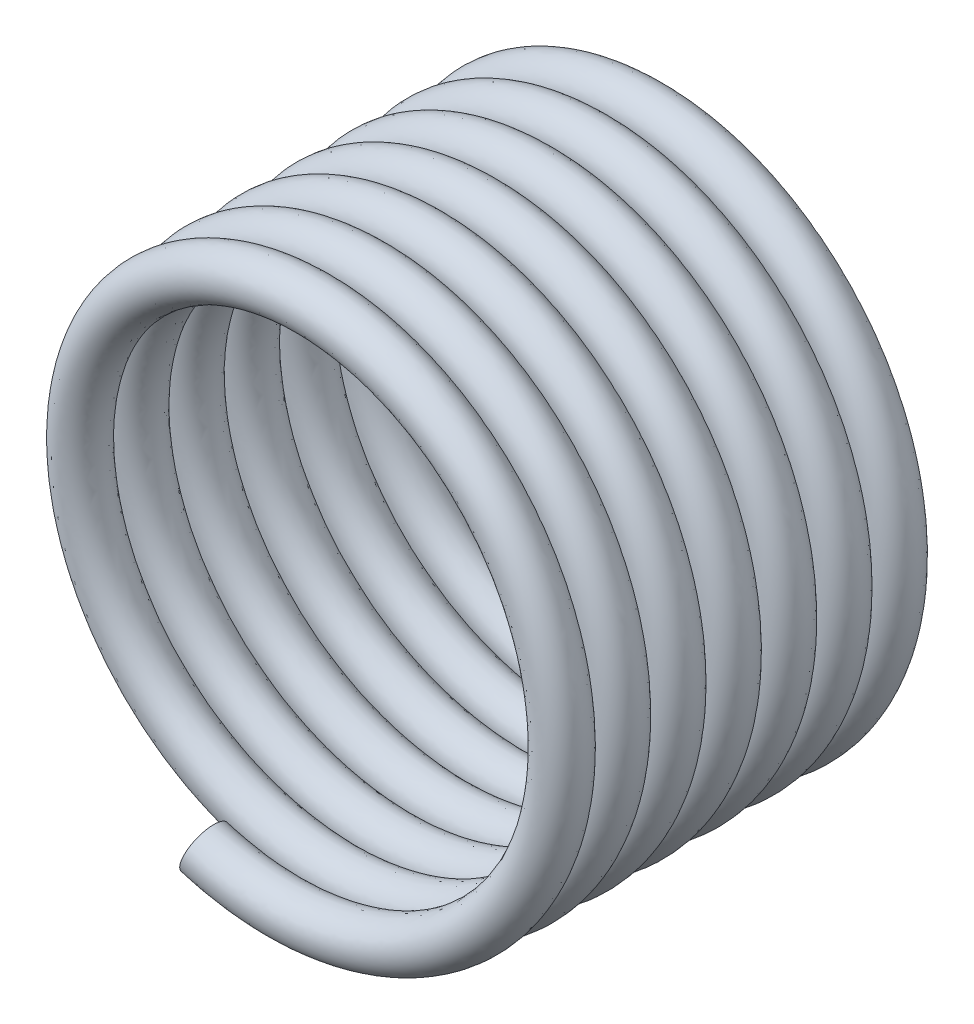
from build123d import *

# Parameters (mm, degrees)
SWEEP1_PITCH       = 1.123497428
SWEEP1_HEIGHT      = 7.6454
SWEEP1_RADIUS      = 5.3721
SWEEP1_START_ANGLE = -180
SKETCH2_R          = 0.4826


with BuildPart() as part:
    # Sweep1: sweep along a helix
    with BuildLine() as sweep1_path:
        add(Helix(SWEEP1_PITCH, SWEEP1_HEIGHT, SWEEP1_RADIUS, center=(0, 0, 0), direction=(0, 0, 1), lefthand=True, mode=Mode.PRIVATE).rotate(Axis((0, 0, 0), (0, 0, 1)), SWEEP1_START_ANGLE))
    # Sketch2 → Sweep1 (sweep)
    with BuildSketch(Plane(origin=(-1.819733981, -5.054505579, 7.6454), x_dir=(0.03367539440418623, -0.004667898869402006, 0.9994219221789503), z_dir=(-0.9403600058959825, 0.33855043400790064, 0.03326654391983417))):
        with Locations((0.001589314, 0.206647084)):
            Circle(SKETCH2_R)
    sweep(path=sweep1_path.line, is_frenet=True)


solid = part.part
